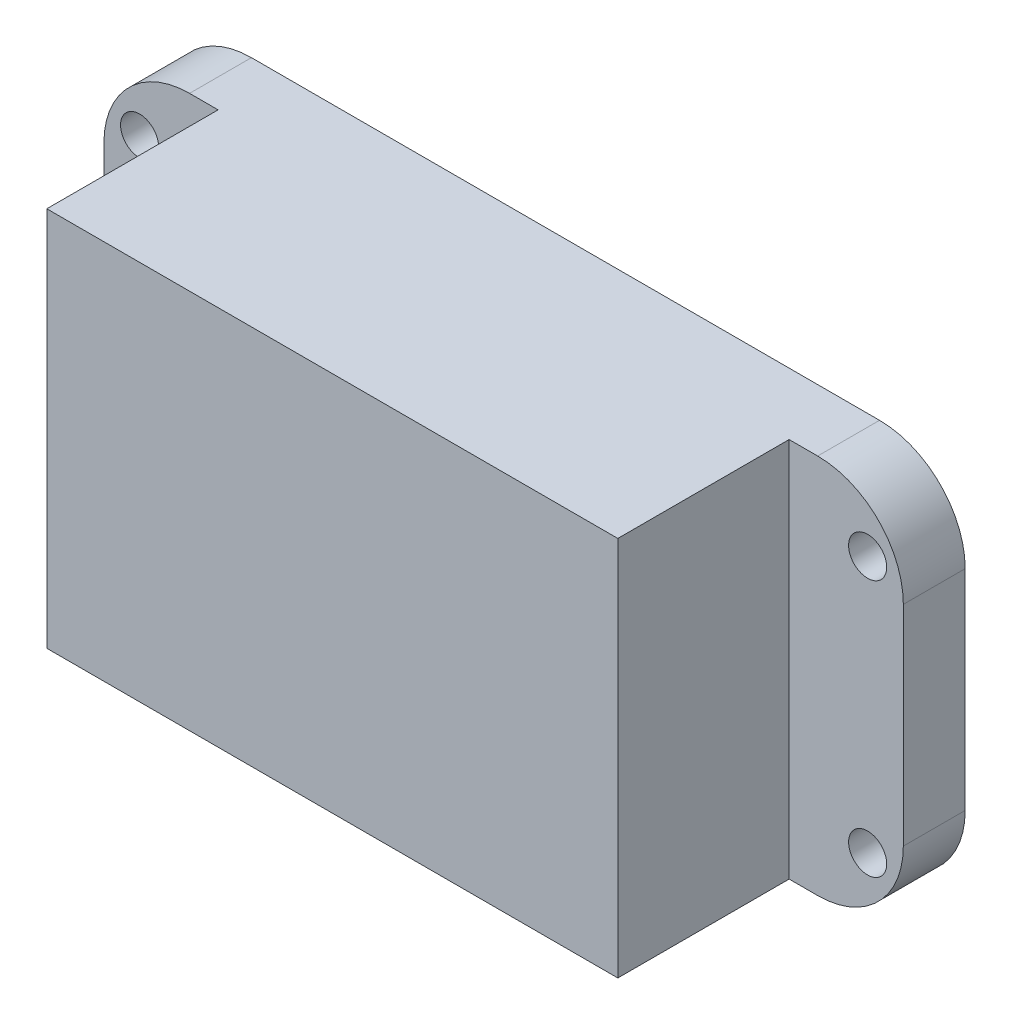
from build123d import *

# Parameters (mm, degrees)
SKETCH_1_R      = 2
EXTRUDE_1_DEPTH = 6.5
SKETCH_2_W      = 60
SKETCH_2_H      = 40
EXTRUDE_2_DEPTH = 18


with BuildPart() as part:
    # ｽｹｯﾁ1 → ﾎﾞｽ - 押し出し1 (new body)
    with BuildSketch(Plane.XY):
        with BuildLine():
            Line((33, -20), (-33, -20))
            ThreePointArc((-33, -20), (-39.363961031, -17.363961031), (-42, -11))
            Line((-42, -11), (-42, 11))
            ThreePointArc((-42, 11), (-39.363961031, 17.363961031), (-33, 20))
            Line((-33, 20), (33, 20))
            ThreePointArc((33, 20), (39.363961031, 17.363961031), (42, 11))
            Line((42, 11), (42, -11))
            ThreePointArc((42, -11), (39.363961031, -17.363961031), (33, -20))
        make_face()
        with Locations(Location((-38.25, 13.5, 0), (0, 0, 180))):
            Circle(SKETCH_1_R, mode=Mode.SUBTRACT)
        with Locations(Location((38.25, 13.5, 0), (0, 0, 180))):
            Circle(SKETCH_1_R, mode=Mode.SUBTRACT)
        with Locations(Location((38.25, -13.5, 0), (0, 0, 180))):
            Circle(SKETCH_1_R, mode=Mode.SUBTRACT)
        with Locations(Location((-38.25, -13.5, 0), (0, 0, 180))):
            Circle(SKETCH_1_R, mode=Mode.SUBTRACT)
    extrude(amount=EXTRUDE_1_DEPTH)

    # ｽｹｯﾁ2 → ﾎﾞｽ - 押し出し2 (add)
    with BuildSketch(Plane.XY.offset(6.5)):
        Rectangle(SKETCH_2_W, SKETCH_2_H)
    extrude(amount=EXTRUDE_2_DEPTH)


solid = part.part
